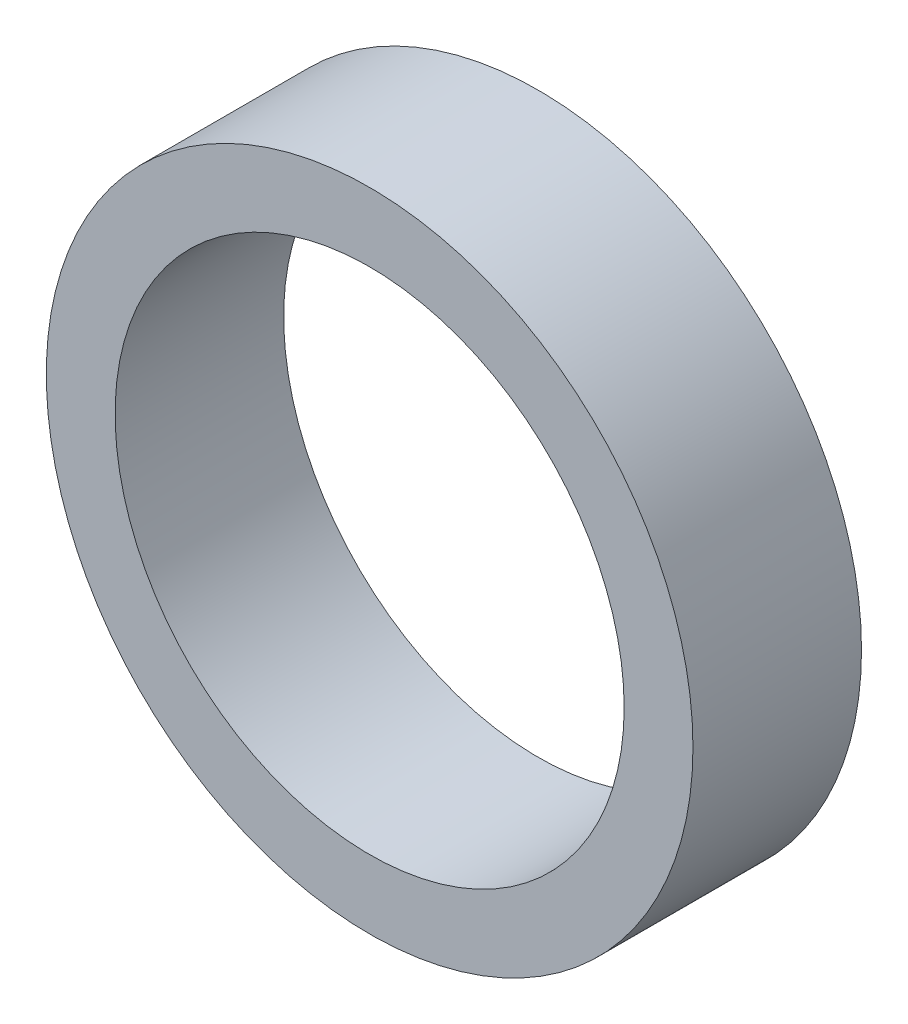
from build123d import *

# Parameters (mm, degrees)
SKETCH_1_R      = 9.4
SKETCH_1_R_2    = 7.4
EXTRUDE_1_DEPTH = 4.9


with BuildPart() as part:
    # 草图1 → 拉伸-薄壁1 (new body)
    with BuildSketch(Plane.XY):
        Circle(SKETCH_1_R)
        Circle(SKETCH_1_R_2, mode=Mode.SUBTRACT)
    extrude(amount=EXTRUDE_1_DEPTH)


solid = part.part
